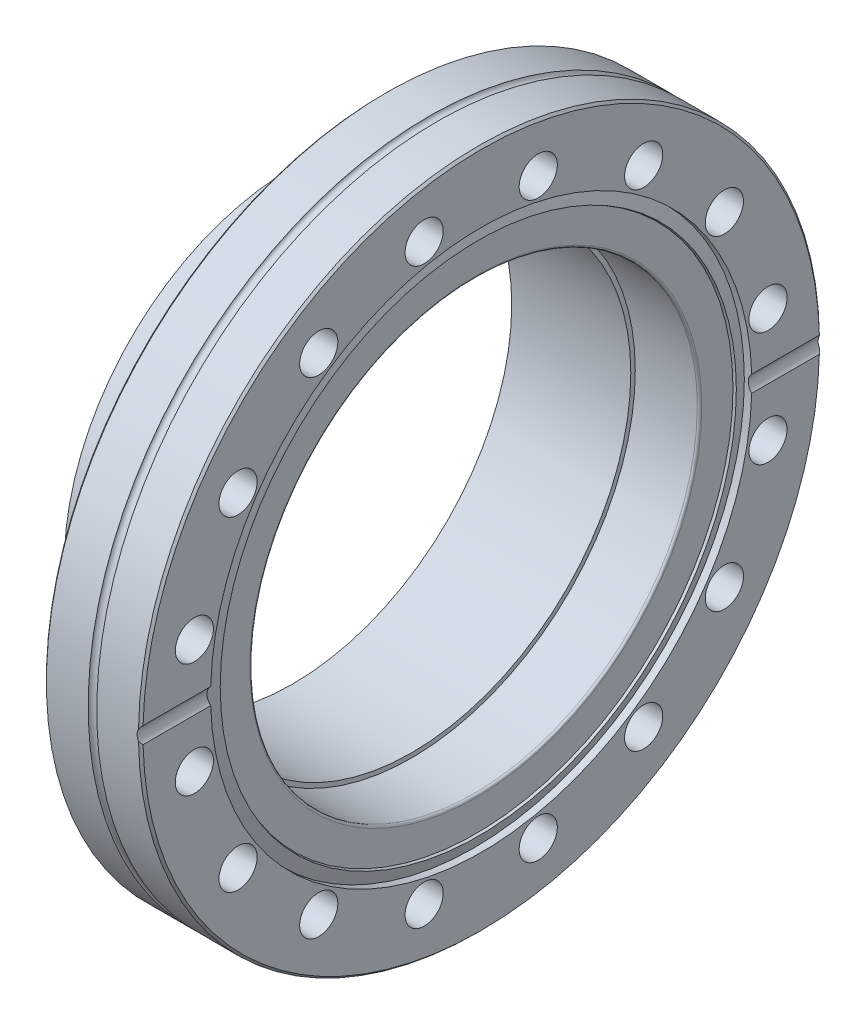
from build123d import *

# Parameters (mm, degrees)
PATTERN_CIRCULAR_1_COUNT = 16
SKETCH_6_R               = 2.5
CUT_EXTRUDE_1_DEPTH      = 17
PATTERN_CIRCULAR_2_COUNT = 2
SKETCH_8_W               = 93
SKETCH_8_H               = 2


with BuildPart() as part:
    # Эскиз1 → Повернуть2 (revolve)
    with BuildSketch(Plane.XY):
        with BuildLine():
            Line((-12.053939201, 75.8), (-21.35, 75.8))
            Line((-21.35, 75.8), (-21.85, 75.3))
            Line((-21.85, 75.3), (-21.85, 51))
            Line((-21.85, 51), (-15.85, 51))
            Line((-15.85, 51), (-15.85, 50.8))
            Line((-15.85, 50.8), (-15.85, 49.8))
            Line((-15.85, 49.8), (-2.05, 49.8))
            ThreePointArc((-2.05, 49.8), (-1.696446609, 49.946446609), (-1.55, 50.3))
            Line((-1.55, 50.3), (-1.55, 57.249816371))
            Line((-1.55, 57.249816371), (-1, 57.45))
            Line((-1, 57.45), (-2.019116656, 60.25))
            Line((-2.019116656, 60.25), (-0.35, 60.25))
            Line((-0.35, 60.25), (-0.35, 75.3))
            Line((-0.35, 75.3), (-0.85, 75.8))
            Line((-0.85, 75.8), (-10.146060799, 75.8))
            ThreePointArc((-10.146060799, 75.8), (-11.1, 75.1), (-12.053939201, 75.8))
        make_face()
    revolve(axis=Axis((0, 0, 0), (-1, 0, 0)))

    # Эскиз2 → Отверстие с зазором M81 (revolve, cut)
    with BuildSketch(Plane(origin=(-0.35, 63.849121754, -12.700379963), x_dir=(0, 0, -1), z_dir=(0, 1, 0))):
        Polygon((0, 0), (0, 21.5), (4.275, 21.5), (4.25, 21.475), (4.25, 0), align=None)
    hole_wizard_m81 = revolve(axis=Axis((6, 63.849121754, -12.700379963), (-1, 0, 0)), mode=Mode.SUBTRACT)

    # Круговой массив1: Отверстие с зазором M81 ×16 about axis
    pattern_circular_1_axis = Axis((-110.150658921, 0, 0), (1, 0, 0))
    for i in range(1, PATTERN_CIRCULAR_1_COUNT):
        add(hole_wizard_m81.rotate(pattern_circular_1_axis, i * 360 / PATTERN_CIRCULAR_1_COUNT), mode=Mode.SUBTRACT)

    # Эскиз6 → Вырез-Вытянуть1 (cut)
    with BuildSketch(Plane(origin=(0, 0, -75.8), x_dir=(-1, 0, 0), z_dir=(0, 0, -1))):
        with Locations((-1.35, 0)):
            Circle(SKETCH_6_R)
    cut_extrude_1 = extrude(amount=-CUT_EXTRUDE_1_DEPTH, mode=Mode.SUBTRACT)

    # Круговой массив2: Вырез-Вытянуть1 ×2 about axis
    pattern_circular_2_axis = Axis((-110.150658921, 0, 0), (1, 0, 0))
    for i in range(1, PATTERN_CIRCULAR_2_COUNT):
        add(cut_extrude_1.rotate(pattern_circular_2_axis, i * 360 / PATTERN_CIRCULAR_2_COUNT), mode=Mode.SUBTRACT)


with BuildPart() as body_2:
    # Эскиз1<5> → Повернуть3 (revolve)
    with BuildSketch(Plane.XY):
        Polygon((-15.85, 49.8), (-15.85, 50.8), (-135.35, 50.8), (-135.35, 48.8), (-15.85, 48.8), align=None)
    revolve(axis=Axis((0, 0, 0), (-1, 0, 0)))

    # Эскиз8 → Вырез-Повернуть1 (revolve, cut)
    with BuildSketch(Plane.XY):
        with Locations((-88.85, 49.8)):
            Rectangle(SKETCH_8_W, SKETCH_8_H)
    revolve(axis=Axis((0, 0, 0), (-1, 0, 0)), mode=Mode.SUBTRACT)


solid = Compound([part.part, body_2.part])
